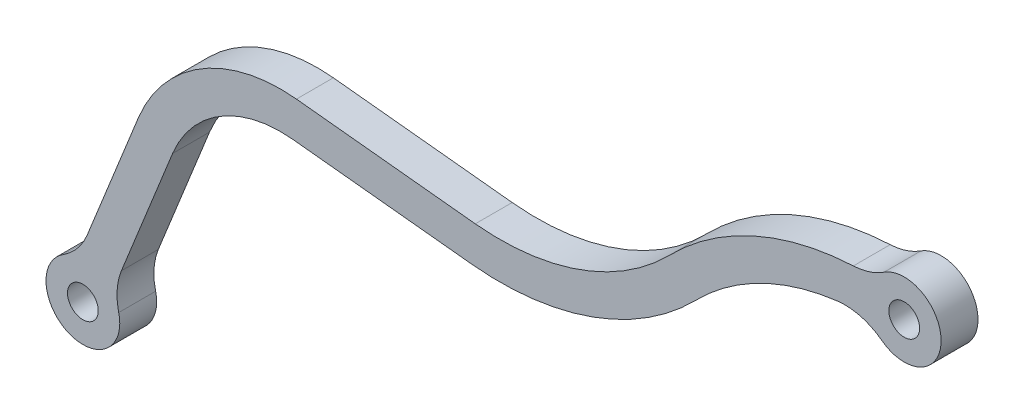
from build123d import *

# Parameters (mm, degrees)
EXTRUDE_THIN1_DEPTH   = 3
SKETCH1_3_R           = 3
BOSS_EXTRUDE1_DEPTH   = 3
FILLET1_R             = 5
F_2_5MM_DOWEL_HOLE1_D = 2.5


with BuildPart() as part:
    # Sketch1 → Extrude-Thin1 (new body)
    with BuildSketch(Plane.XY):
        with BuildLine():
            ThreePointArc((67.660273857, 34.169358704), (57.237958415, 33.249482811), (48.374242711, 27.690222541))
            ThreePointArc((48.374242711, 27.690222541), (41.120514889, 23.027861475), (32.560988498, 21.984460302))
            Line((32.560988498, 21.984460302), (18.0194176, 23.497567077))
            ThreePointArc((18.0194176, 23.497567077), (10.297542455, 21.776854665), (5.1667157, 15.754992513))
            Line((5.1667157, 15.754992513), (-0.737799909, 1.088733357))
            Line((-0.737799909, 1.088733357), (2.04513605, -0.031653828))
            Line((2.04513605, -0.031653828), (7.949651659, 14.634605328))
            ThreePointArc((7.949651659, 14.634605328), (11.845577871, 19.207110251), (17.7089323, 20.513677186))
            Line((17.7089323, 20.513677186), (32.250503198, 19.000570412))
            ThreePointArc((32.250503198, 19.000570412), (42.138725285, 20.205938799), (50.518449629, 25.592038399))
            ThreePointArc((50.518449629, 25.592038399), (58.193335463, 30.40567292), (67.217776658, 31.202172119))
            Line((67.217776658, 31.202172119), (67.660273857, 34.169358704))
        make_face()
    extrude(amount=EXTRUDE_THIN1_DEPTH)

    # Sketch1<3> → Boss-Extrude1 (add, through all)
    with BuildSketch(Plane.XY):
        with Locations((0.653668071, 0.528539764)):
            Circle(SKETCH1_3_R)
        with Locations((67.439025258, 32.685765412)):
            Circle(SKETCH1_3_R)
    extrude(amount=BOSS_EXTRUDE1_DEPTH)

    # Fillet1
    fillet1_edges = [part.edges().sort_by_distance(p)[0] for p in [
        (0.232483855, 3.498826595, 1.5),
        (3.015419815, 2.37843941, 1.5),
        (64.723514108, 31.410618677, 1.5),
        (64.980819062, 34.405423023, 1.5),
    ]]
    fillet(fillet1_edges, radius=FILLET1_R)

    # Ø2.5mm Dowel Hole1 (through all)
    with Locations(Plane.XY.offset(3)):
        with Locations((67.439025258, 32.685765412), (0.653668071, 0.528539764)):
            Hole(F_2_5MM_DOWEL_HOLE1_D / 2)


solid = part.part
